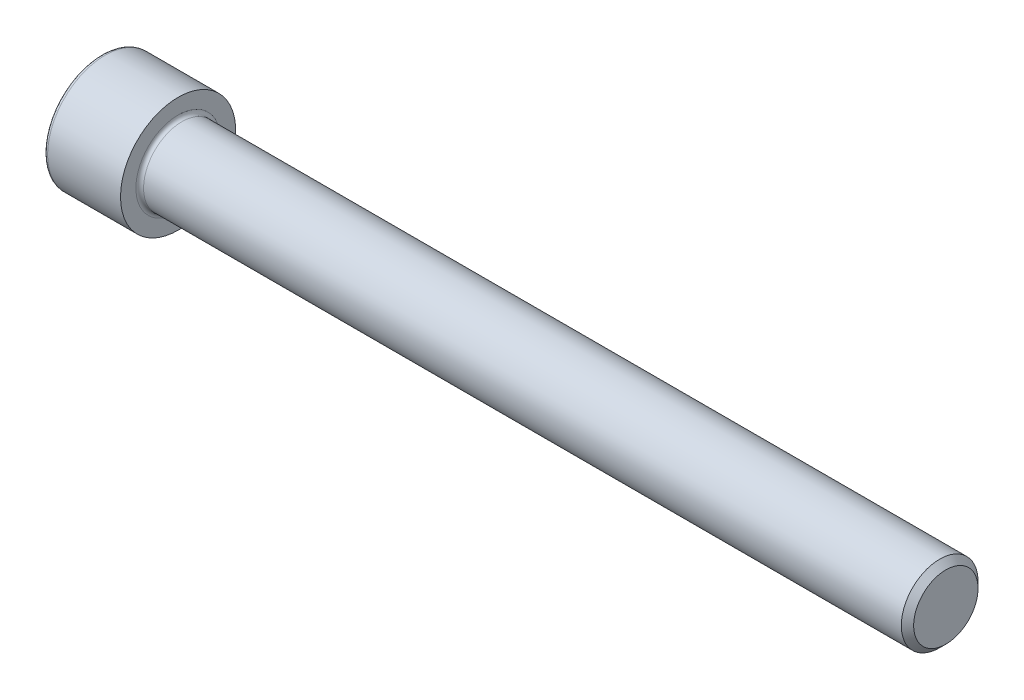
from build123d import *

# Parameters (mm, degrees)
FILLET1_R   = 0.6
FILLET2_R   = 0.6
HEX_2_DEPTH = 6


with BuildPart() as part:
    # BodySke → Base-Revolve (revolve)
    with BuildSketch(Plane.XY, mode=Mode.PRIVATE) as base_revolve_sk:
        Polygon((0, 0), (0, 9), (12, 9), (12, 6), (131.036, 6), (132, 5.036), (132, 0), align=None)
    revolve(base_revolve_sk.sketch.rotate(Axis((-31.75, 0, 0), (1, 0, 0)), 90), axis=Axis((-31.75, 0, 0), (1, 0, 0)))

    # Fillet1
    fillet1_edges = [part.edges().sort_by_distance(p)[0] for p in [
        (12, 0, -6),
    ]]
    fillet(fillet1_edges, radius=FILLET1_R)

    # Fillet2
    fillet2_edges = [part.edges().sort_by_distance(p)[0] for p in [
        (0, 0, -9),
    ]]
    fillet(fillet2_edges, radius=FILLET2_R)

    # Sketch2 → Hex-PreBroach (revolve, cut)
    with BuildSketch(Plane.XY, mode=Mode.PRIVATE) as hex_prebroach_sk:
        Polygon((0, 5.0575), (6, 5.0575), (8.919948986, 0), (0, 0), align=None)
    revolve(hex_prebroach_sk.sketch.rotate(Axis((0, 0, 0), (1, 0, 0)), 90), axis=Axis((0, 0, 0), (1, 0, 0)), mode=Mode.SUBTRACT)

    # Sketch3 → Hex 2 (cut)
    with BuildSketch(Plane(origin=(0, 0, 0), x_dir=(0, 0.500000000000001, 0.866025403784438), z_dir=(-1, 0, 0))):
        Polygon((2.919948986, 5.0575), (-2.919948986, 5.0575), (-5.839897973, 0), (-2.919948986, -5.0575), (2.919948986, -5.0575), (5.839897973, 0), align=None)
    extrude(amount=-HEX_2_DEPTH, mode=Mode.SUBTRACT)


solid = part.part
